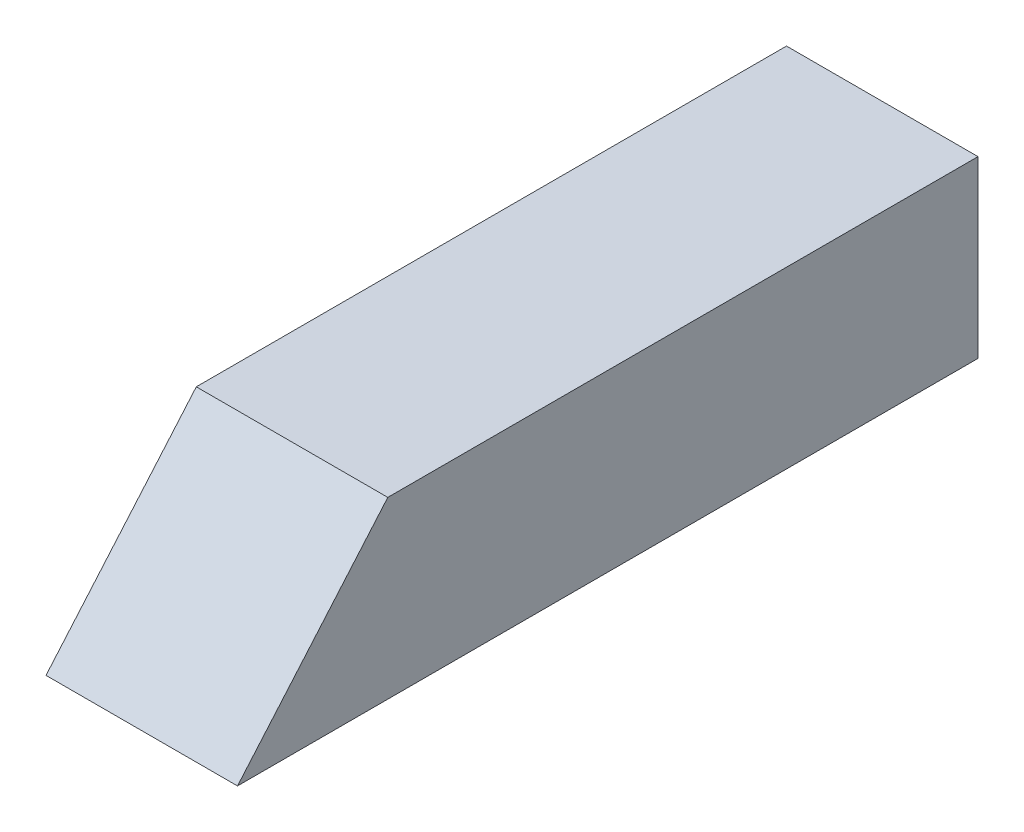
from build123d import *

# Parameters (mm, degrees)
SKETCH1_W           = 43.96578767
SKETCH1_H           = 40.124116903
BOSS_EXTRUDE1_DEPTH = 170
CUT_EXTRUDE1_DEPTH  = 181.119225078


with BuildPart() as part:
    # Sketch1 → Boss-Extrude1 (new body)
    with BuildSketch(Plane.XY):
        with Locations((21.982893835, -20.062058452)):
            Rectangle(SKETCH1_W, SKETCH1_H)
    extrude(amount=BOSS_EXTRUDE1_DEPTH)

    # Sketch2 → Cut-Extrude1 (cut, through all)
    with BuildSketch(Plane(origin=(43.96578767, 0, 0), x_dir=(0, 0, -1), z_dir=(1, 0, 0))):
        Polygon((-170, -40.124116903), (-135.498420038, 0), (-170, 0), align=None)
    extrude(amount=-CUT_EXTRUDE1_DEPTH, mode=Mode.SUBTRACT)


solid = part.part
